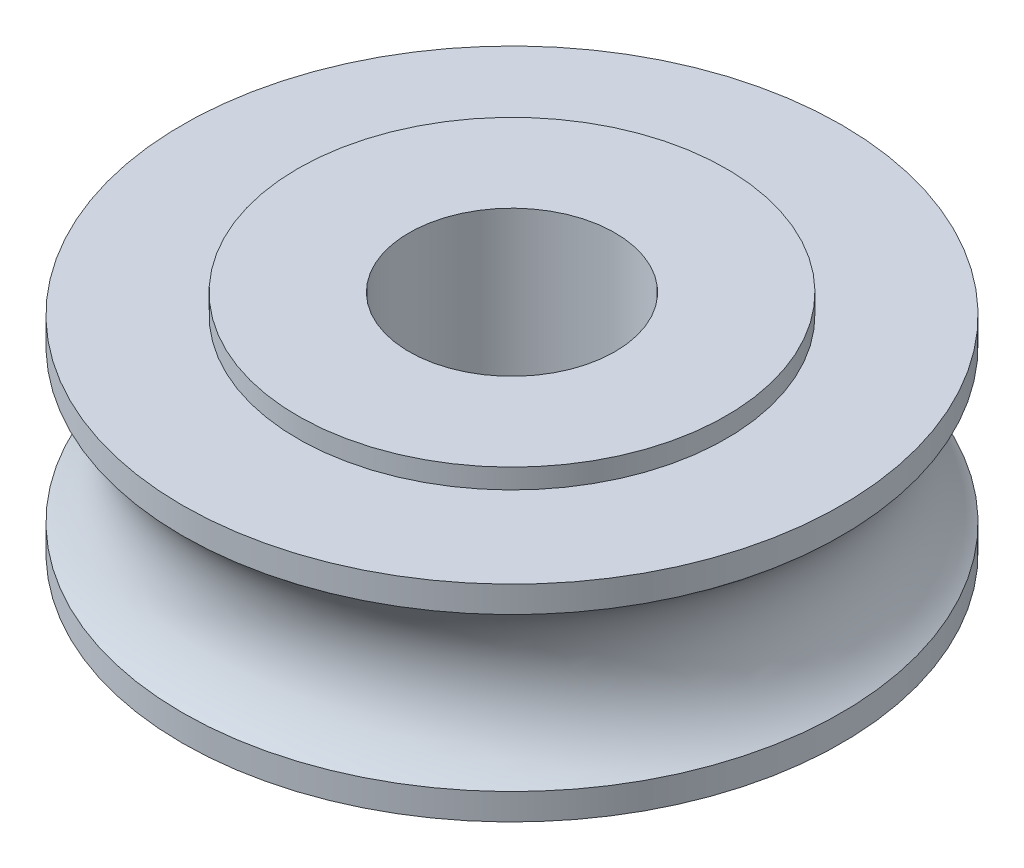
from build123d import *
from build123d.topology import SkipClean

# Parameters (mm, degrees)
SKETCH1_R           = 12.7
BOSS_EXTRUDE1_DEPTH = 7.9375
SKETCH2_R           = 3.96875
CUT_EXTRUDE1_DEPTH  = 20.636290542
SKETCH5_R           = 8.255
SKETCH5_R_2         = 3.96875
BOSS_EXTRUDE2_DEPTH = 4.7625


with BuildPart() as part:
    # Sketch1 → Boss-Extrude1 (new body)
    with BuildSketch(Plane(origin=(0, 0, 0), x_dir=(1, 0, 0), z_dir=(0, 1, 0))):
        with Locations(Location((0, 0, 0), (0, 0, 270))):
            Circle(SKETCH1_R)
    extrude(amount=BOSS_EXTRUDE1_DEPTH)

    # Sketch2 → Cut-Extrude1 (cut, through all)
    with BuildSketch(Plane(origin=(0, 7.9375, 0), x_dir=(1, 0, 0), z_dir=(0, 1, 0))):
        with Locations(Location((0, 0, 0), (0, 0, 270))):
            Circle(SKETCH2_R)
    extrude(amount=-CUT_EXTRUDE1_DEPTH, mode=Mode.SUBTRACT)

    # Sketch4 → Cut-Revolve1 (revolve, cut)
    with BuildSketch(Plane(origin=(0, 0, 0), x_dir=(0, 0, -1), z_dir=(1, 0, 0))):
        with BuildLine():
            Line((-12.7, 6.9215), (-12.7, 1.016))
            ThreePointArc((-12.7, 1.016), (-11.2268, 3.96875), (-12.7, 6.9215))
        make_face()
    revolve(axis=Axis((0, 8.334375, 0), (0, -1, 0)), mode=Mode.SUBTRACT)

    # Sketch5 → Boss-Extrude2 (add, symmetric)
    with SkipClean():  # the faces are left unmerged after this step: merging them gives an invalid solid
        with BuildSketch(Plane(origin=(0, 3.937, 0), x_dir=(-1, 0, 0), z_dir=(0, -1, 0))):
            Circle(SKETCH5_R)
            with Locations(Location((0, 0, 0), (0, 0, 180))):
                Circle(SKETCH5_R_2, mode=Mode.SUBTRACT)
        extrude(amount=BOSS_EXTRUDE2_DEPTH, both=True)


solid = part.part
